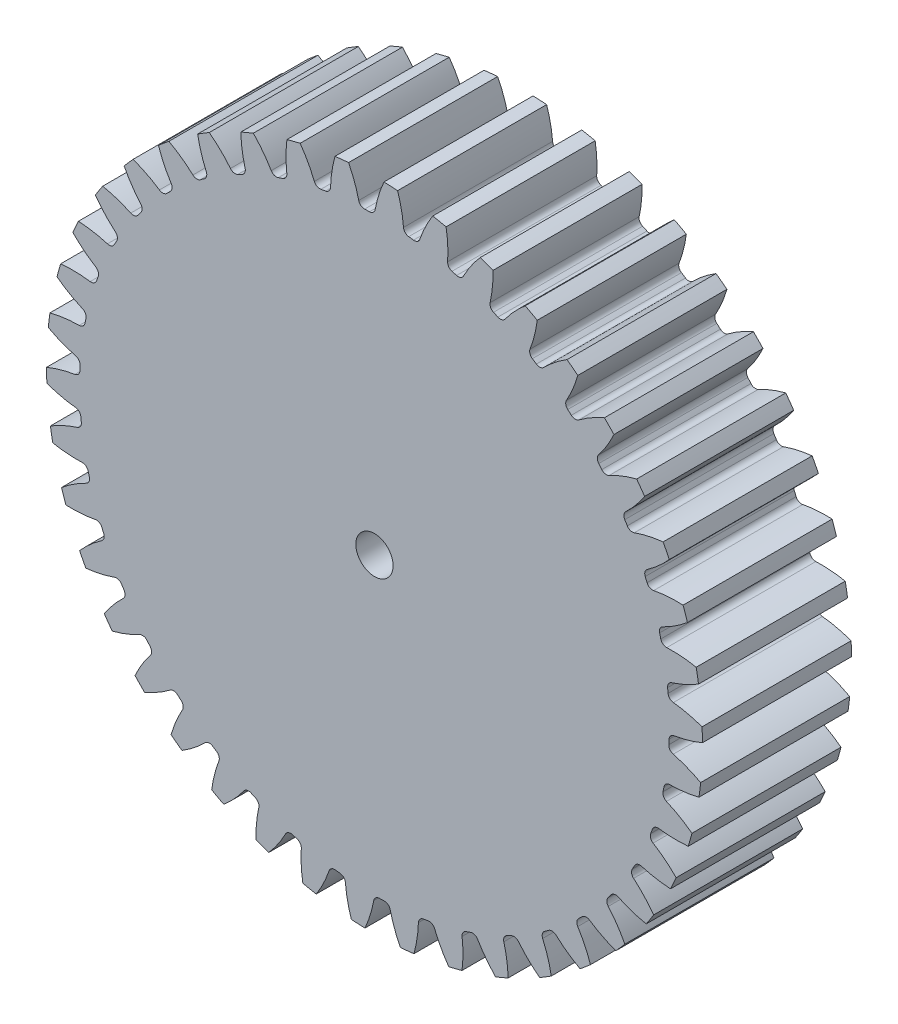
from build123d import *

# Parameters (mm, degrees)
SKETCH3_R         = 55.88
GEARBODY_DEPTH    = 25.4
TOOTHCUT_DEPTH    = 84.007883963
CIRPATTERN1_COUNT = 42
BOREDIA_R         = 3.175
BORE_DEPTH        = 12700


with BuildPart() as part:
    # Sketch3 → gearBody (new body)
    with BuildSketch(Plane.XY):
        Circle(SKETCH3_R)
    extrude(amount=GEARBODY_DEPTH)

    # Sketch2 → toothCut (cut, through all)
    with BuildSketch(Plane.XY):
        with BuildLine():
            ThreePointArc((50.157010178, -2.907319624), (50.179053062, -2.498161564), (50.197758277, -2.088837338))
            ThreePointArc((50.197758277, -2.088837338), (50.45095315, -1.462845439), (51.043252606, -1.138569547))
            ThreePointArc((51.043252606, -1.138569547), (59.045249163, 1.888601607), (65.195059875, 7.836335823))
            ThreePointArc((65.195059875, 7.836335823), (65.58310324, -3.265051406), (64.094347619, -14.273002294))
            ThreePointArc((64.094347619, -14.273002294), (58.565697733, -7.743856521), (50.903939554, -3.936866147))
            ThreePointArc((50.903939554, -3.936866147), (50.346777203, -3.555364358), (50.157010178, -2.907319624))
        make_face()
    toothcut = extrude(amount=TOOTHCUT_DEPTH, mode=Mode.SUBTRACT)

    # CirPattern1: toothCut ×42 about axis
    cirpattern1_axis = Axis((0, 0, 25.4), (0, 0, -1))
    for i in range(1, CIRPATTERN1_COUNT):
        add(toothcut.rotate(cirpattern1_axis, i * 360 / CIRPATTERN1_COUNT), mode=Mode.SUBTRACT)

    # boreDia → bore (cut, symmetric)
    with BuildSketch(Plane.XY):
        Circle(BOREDIA_R)
    extrude(amount=BORE_DEPTH, both=True, mode=Mode.SUBTRACT)


solid = part.part
